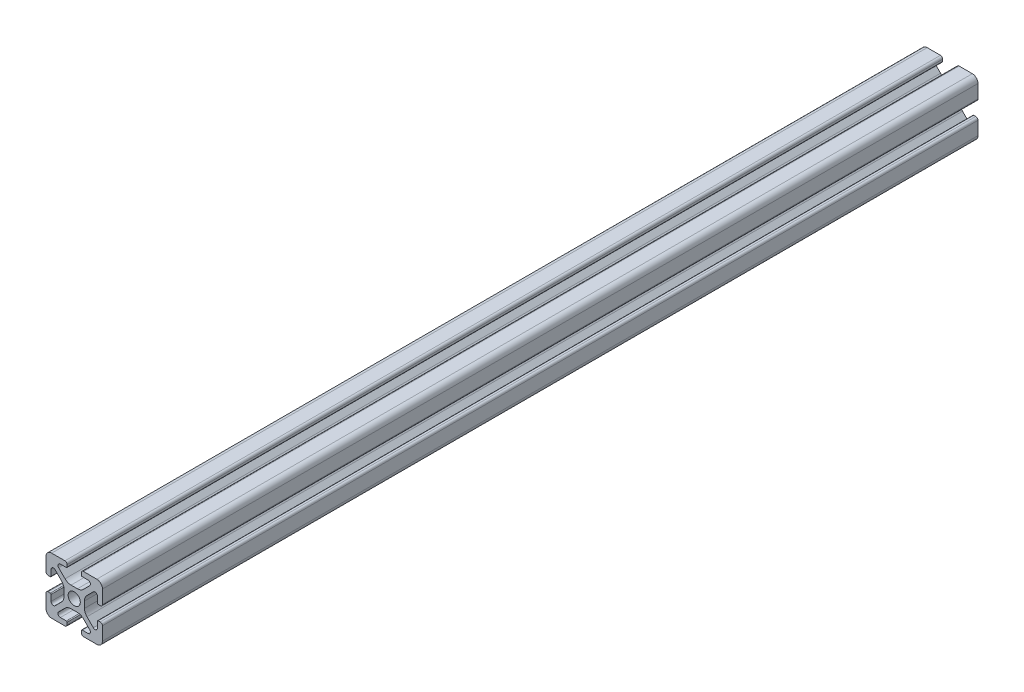
from build123d import *

# Parameters (mm, degrees)
SKETCH1_R           = 2.1463
BOSS_EXTRUDE1_DEPTH = 155


with BuildPart() as part:
    # Sketch1 → Boss-Extrude1 (new, symmetric)
    with BuildSketch(Plane.XY):
        with BuildLine():
            Line((-9.9949, 7.9883), (-9.9949, 3.2893))
            ThreePointArc((-9.9949, 3.2893), (-9.76427588, 2.73252412), (-9.2075, 2.5019))
            Line((-9.2075, 2.5019), (-8.4963, 2.5019))
            ThreePointArc((-8.4963, 2.5019), (-8.280773853, 2.591173853), (-8.1915, 2.8067))
            Line((-8.1915, 2.8067), (-8.1915, 4.9149))
            ThreePointArc((-8.1915, 4.9149), (-7.674065253, 5.689295824), (-6.760603096, 5.507596904))
            Line((-6.760603096, 5.507596904), (-4.505765747, 3.252759555))
            ThreePointArc((-4.505765747, 3.252759555), (-3.856054457, 2.280397894), (-3.627906192, 1.133419111))
            Line((-3.627906192, 1.133419111), (-3.627906192, -1.133419111))
            ThreePointArc((-3.627906192, -1.133419111), (-3.856054457, -2.280397894), (-4.505765747, -3.252759555))
            Line((-4.505765747, -3.252759555), (-6.760603096, -5.507596904))
            ThreePointArc((-6.760603096, -5.507596904), (-7.674065253, -5.689295824), (-8.1915, -4.9149))
            Line((-8.1915, -4.9149), (-8.1915, -2.8067))
            ThreePointArc((-8.1915, -2.8067), (-8.280773853, -2.591173853), (-8.4963, -2.5019))
            Line((-8.4963, -2.5019), (-9.2075, -2.5019))
            ThreePointArc((-9.2075, -2.5019), (-9.76427588, -2.73252412), (-9.9949, -3.2893))
            Line((-9.9949, -3.2893), (-9.9949, -7.9883))
            ThreePointArc((-9.9949, -7.9883), (-9.407180467, -9.407180467), (-7.9883, -9.9949))
            Line((-7.9883, -9.9949), (-3.2893, -9.9949))
            ThreePointArc((-3.2893, -9.9949), (-2.73252412, -9.76427588), (-2.5019, -9.2075))
            Line((-2.5019, -9.2075), (-2.5019, -8.4963))
            ThreePointArc((-2.5019, -8.4963), (-2.591173853, -8.280773853), (-2.8067, -8.1915))
            Line((-2.8067, -8.1915), (-4.9149, -8.1915))
            ThreePointArc((-4.9149, -8.1915), (-5.689295824, -7.674065253), (-5.507596904, -6.760603096))
            Line((-5.507596904, -6.760603096), (-3.252759555, -4.505765747))
            ThreePointArc((-3.252759555, -4.505765747), (-2.280397894, -3.856054457), (-1.133419111, -3.627906192))
            Line((-1.133419111, -3.627906192), (1.133419111, -3.627906192))
            ThreePointArc((1.133419111, -3.627906192), (2.280397894, -3.856054457), (3.252759555, -4.505765747))
            Line((3.252759555, -4.505765747), (5.507596904, -6.760603096))
            ThreePointArc((5.507596904, -6.760603096), (5.689295824, -7.674065253), (4.9149, -8.1915))
            Line((4.9149, -8.1915), (2.8067, -8.1915))
            ThreePointArc((2.8067, -8.1915), (2.591173853, -8.280773853), (2.5019, -8.4963))
            Line((2.5019, -8.4963), (2.5019, -9.2075))
            ThreePointArc((2.5019, -9.2075), (2.73252412, -9.76427588), (3.2893, -9.9949))
            Line((3.2893, -9.9949), (7.9883, -9.9949))
            ThreePointArc((7.9883, -9.9949), (9.407180467, -9.407180467), (9.9949, -7.9883))
            Line((9.9949, -7.9883), (9.9949, -3.2893))
            ThreePointArc((9.9949, -3.2893), (9.76427588, -2.73252412), (9.2075, -2.5019))
            Line((9.2075, -2.5019), (8.4963, -2.5019))
            ThreePointArc((8.4963, -2.5019), (8.280773853, -2.591173853), (8.1915, -2.8067))
            Line((8.1915, -2.8067), (8.1915, -4.9149))
            ThreePointArc((8.1915, -4.9149), (7.674065253, -5.689295824), (6.760603096, -5.507596904))
            Line((6.760603096, -5.507596904), (4.505765747, -3.252759555))
            ThreePointArc((4.505765747, -3.252759555), (3.856054457, -2.280397894), (3.627906192, -1.133419111))
            Line((3.627906192, -1.133419111), (3.627906192, 1.133419111))
            ThreePointArc((3.627906192, 1.133419111), (3.856054457, 2.280397894), (4.505765747, 3.252759555))
            Line((4.505765747, 3.252759555), (6.760603096, 5.507596904))
            ThreePointArc((6.760603096, 5.507596904), (7.674065253, 5.689295824), (8.1915, 4.9149))
            Line((8.1915, 4.9149), (8.1915, 2.8067))
            ThreePointArc((8.1915, 2.8067), (8.280773853, 2.591173853), (8.4963, 2.5019))
            Line((8.4963, 2.5019), (9.2075, 2.5019))
            ThreePointArc((9.2075, 2.5019), (9.76427588, 2.73252412), (9.9949, 3.2893))
            Line((9.9949, 3.2893), (9.9949, 7.9883))
            ThreePointArc((9.9949, 7.9883), (9.407180467, 9.407180467), (7.9883, 9.9949))
            Line((7.9883, 9.9949), (3.2893, 9.9949))
            ThreePointArc((3.2893, 9.9949), (2.73252412, 9.76427588), (2.5019, 9.2075))
            Line((2.5019, 9.2075), (2.5019, 8.4963))
            ThreePointArc((2.5019, 8.4963), (2.591173853, 8.280773853), (2.8067, 8.1915))
            Line((2.8067, 8.1915), (4.9149, 8.1915))
            ThreePointArc((4.9149, 8.1915), (5.689295824, 7.674065253), (5.507596904, 6.760603096))
            Line((5.507596904, 6.760603096), (3.252759555, 4.505765747))
            ThreePointArc((3.252759555, 4.505765747), (2.280397894, 3.856054457), (1.133419111, 3.627906192))
            Line((1.133419111, 3.627906192), (-1.133419111, 3.627906192))
            ThreePointArc((-1.133419111, 3.627906192), (-2.280397894, 3.856054457), (-3.252759555, 4.505765747))
            Line((-3.252759555, 4.505765747), (-5.507596904, 6.760603096))
            ThreePointArc((-5.507596904, 6.760603096), (-5.689295824, 7.674065253), (-4.9149, 8.1915))
            Line((-4.9149, 8.1915), (-2.8067, 8.1915))
            ThreePointArc((-2.8067, 8.1915), (-2.591173853, 8.280773853), (-2.5019, 8.4963))
            Line((-2.5019, 8.4963), (-2.5019, 9.2075))
            ThreePointArc((-2.5019, 9.2075), (-2.73252412, 9.76427588), (-3.2893, 9.9949))
            Line((-3.2893, 9.9949), (-7.9883, 9.9949))
            ThreePointArc((-7.9883, 9.9949), (-9.407180467, 9.407180467), (-9.9949, 7.9883))
        make_face()
        Circle(SKETCH1_R, mode=Mode.SUBTRACT)
    extrude(amount=BOSS_EXTRUDE1_DEPTH, both=True)


solid = part.part
